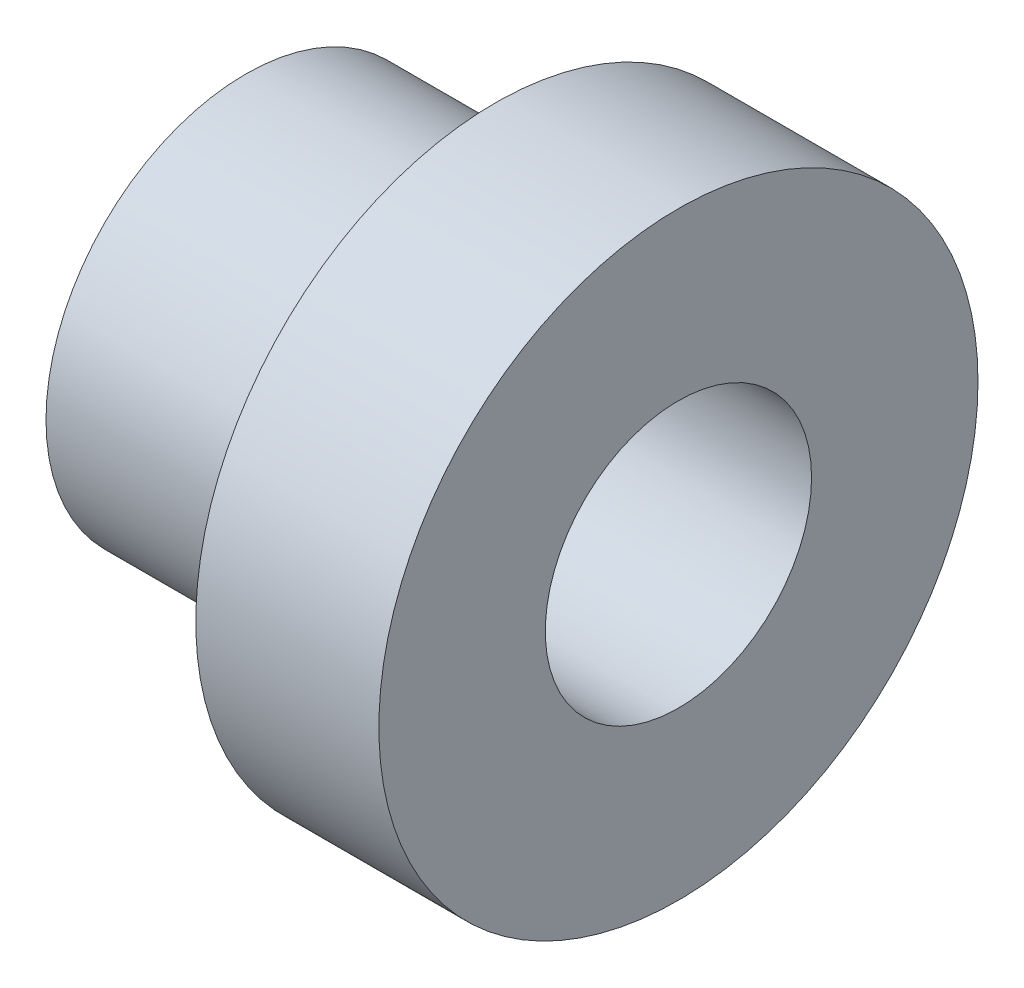
from build123d import *


with BuildPart() as part:
    # 草图1 → 旋转1 (revolve)
    with BuildSketch(Plane.XY, mode=Mode.PRIVATE) as revolve_1_sk:
        Polygon((0, 4), (0, 9), (-5.5, 9), (-5.5, 6), (-13, 6), (-13, 4), align=None)
    revolve(revolve_1_sk.sketch.rotate(Axis((0, 0, 0), (-1, 0, 0)), 90), axis=Axis((0, 0, 0), (-1, 0, 0)))


solid = part.part
